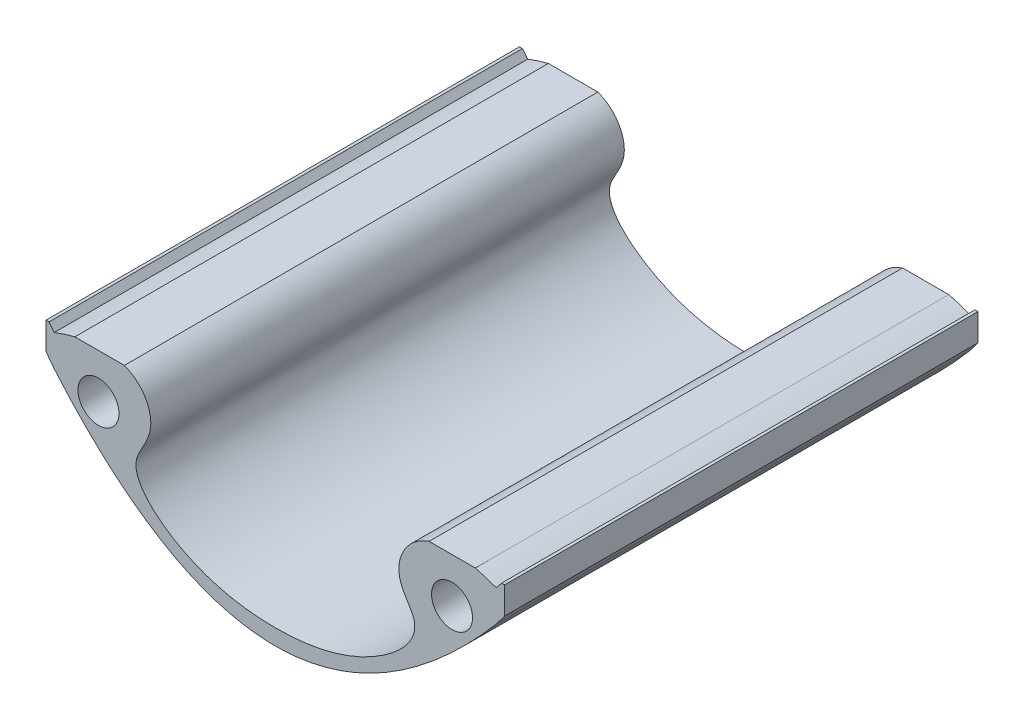
from build123d import *

# Parameters (mm, degrees)
SKETCH_1_R               = 3.25
EXTRUDE_1_DEPTH          = 75
CUT_EXTRUDE_1_DEPTH      = 122.091796509
CUT_EXTRUDE_1_DEPTH_BACK = 122.091796509
SKETCH_2_W               = 92.717171147
SKETCH_2_H               = 72.960489682
SKETCH_3_W               = 30.57870083
SKETCH_3_H               = 110.525424686
SKETCH_3_W_2             = 21.736666855
SKETCH_3_H_2             = 127.47265647
CUT_EXTRUDE_2_DEPTH      = 89.739988429


with BuildPart() as part:
    # 草圖1 → 填料-伸長1 (new body)
    with BuildSketch(Plane.XY):
        with BuildLine():
            Line((-40, 80), (-38, 80))
            add(Edge.make_bspline(
                [(-35, 6), (-63, 40), (-38, 80)],
                knots=[0, 0, 0, 1, 1, 1], degree=2))
            add(Edge.make_bspline(
                [(-35, 6), (-23.912717134, 10.211450087), (-16.862548977, 0.91669383), (-25.21219254, -5.97773989), (-14.476146204, -15.305337799), (0.018424546, -17.830380109), (14.401673974, -15.338256178), (25.43565684, -5.864025043), (16.50438221, 0.543390954), (24.292170801, 10.070987077), (35, 6)],
                knots=[0, 0, 0, 0, 0.10519551, 0.200517345, 0.353331619, 0.503001949, 0.652672279, 0.805486553, 0.900808388, 1, 1, 1, 1], degree=3))
            add(Edge.make_bspline(
                [(35, 6), (63, 40), (38, 80)],
                knots=[0, 0, 0, 1, 1, 1], degree=2))
            Line((38, 80), (40, 80))
            add(Edge.make_bspline(
                [(35, 1), (65, 40), (40, 80)],
                knots=[0, 0, 0, 1, 1, 1], degree=2))
            add(Edge.make_bspline(
                [(-35, 1), (0, -40), (35, 1)],
                knots=[0, 0, 0, 1, 1, 1], degree=2))
            add(Edge.make_bspline(
                [(-35, 1), (-65, 40), (-40, 80)],
                knots=[0, 0, 0, 1, 1, 1], degree=2))
        make_face()
        with Locations((-28, 0)):
            Circle(SKETCH_1_R, mode=Mode.SUBTRACT)
        with Locations((28, 0)):
            Circle(SKETCH_1_R, mode=Mode.SUBTRACT)
    extrude(amount=EXTRUDE_1_DEPTH)

    # 草圖2 → 除料-伸長1 (cut, two sides: drawn at the far end of the back side and taken through both)
    with BuildSketch(Plane(origin=(0, 0, 0), x_dir=(0, 0, -1), z_dir=(1, 0, 0)).offset(-CUT_EXTRUDE_1_DEPTH_BACK)):
        with Locations((-41.189730422, 43.519755159)):
            Rectangle(SKETCH_2_W, SKETCH_2_H)
    extrude(amount=CUT_EXTRUDE_1_DEPTH + CUT_EXTRUDE_1_DEPTH_BACK, mode=Mode.SUBTRACT)

    # 草圖3 → 除料-伸長2 (cut, through all)
    with BuildSketch(Plane(origin=(0, 7.039510318, 0), x_dir=(1, 0, 0), z_dir=(0, 1, 0))):
        with Locations((51.601433927, -42.5)):
            Rectangle(SKETCH_3_W, SKETCH_3_H)
        with Locations((-47.18041694, -41.210536712)):
            Rectangle(SKETCH_3_W_2, SKETCH_3_H_2)
    extrude(amount=-CUT_EXTRUDE_2_DEPTH, mode=Mode.SUBTRACT)


solid = part.part
